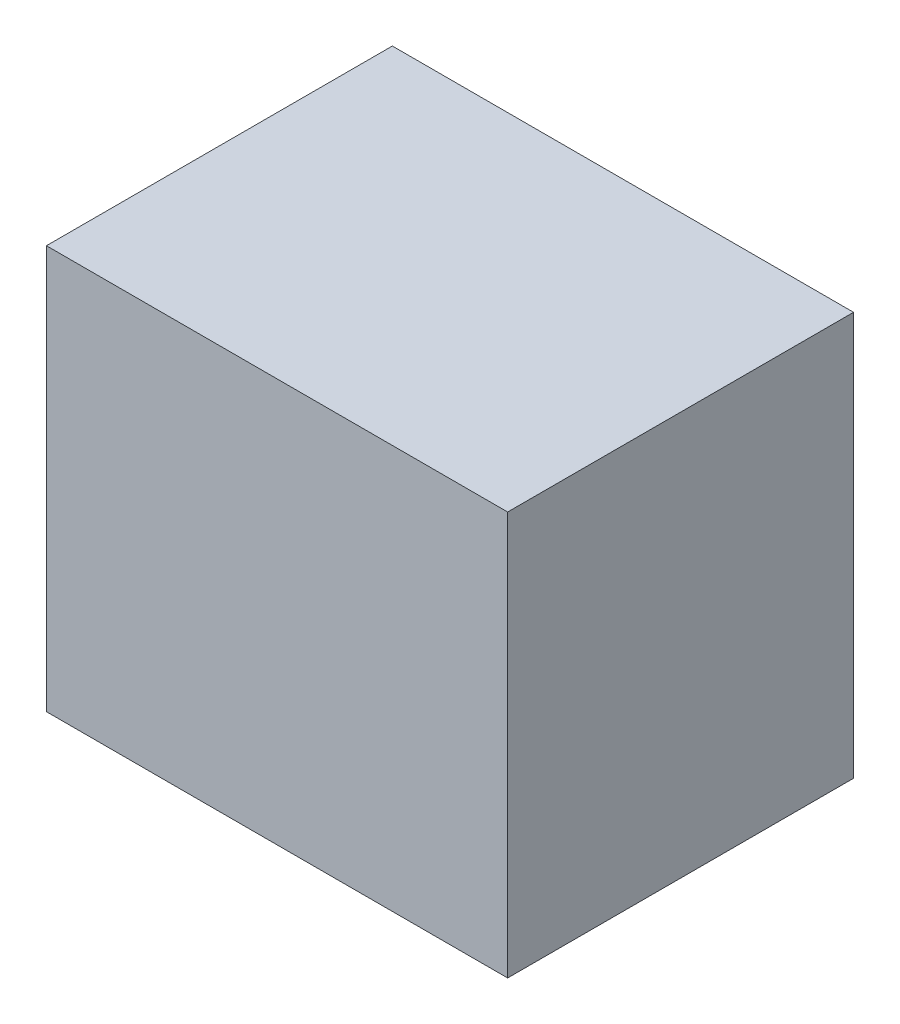
from build123d import *

# Parameters (mm, degrees)
SKETCH1_W           = 800
SKETCH1_H           = 700
BOSS_EXTRUDE1_DEPTH = 600


with BuildPart() as part:
    # Sketch1 → Boss-Extrude1 (new body)
    with BuildSketch(Plane.XY):
        with Locations((400, 350)):
            Rectangle(SKETCH1_W, SKETCH1_H)
    extrude(amount=BOSS_EXTRUDE1_DEPTH)


solid = part.part
